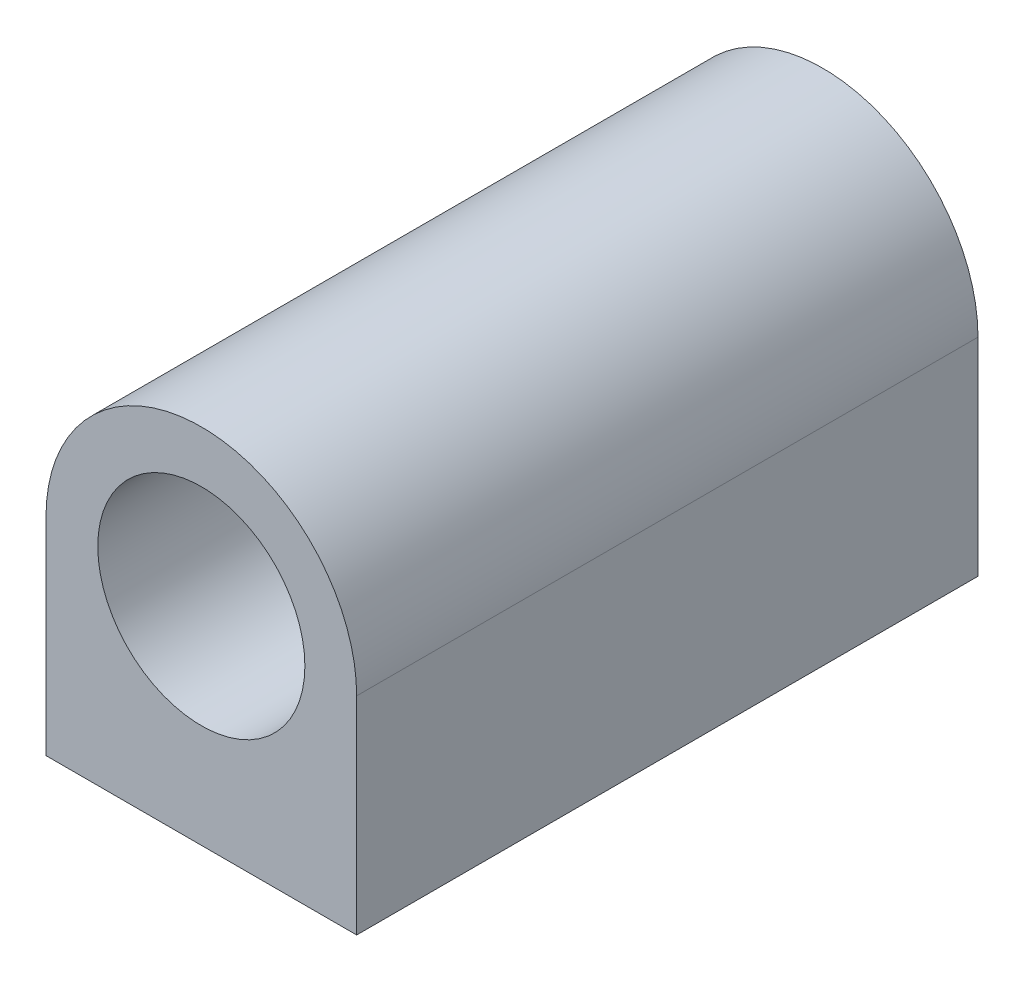
from build123d import *

# Parameters (mm, degrees)
SKETCH1_R           = 12.7
BOSS_EXTRUDE1_DEPTH = 38.1
HOLE1_D             = 3.302
HOLE1_DEPTH         = 12.7
LPATTERN1_COUNT     = 2
LPATTERN1_PITCH     = 25.4


with BuildPart() as part:
    # Sketch1 → Boss-Extrude1 (new, symmetric)
    with BuildSketch(Plane.XY):
        with BuildLine():
            Line((-19.05, 25.4), (-19.05, 0))
            Line((-19.05, 0), (19.05, 0))
            Line((19.05, 0), (19.05, 25.4))
            ThreePointArc((19.05, 25.4), (0, 44.45), (-19.05, 25.4))
        make_face()
        with Locations(Location((0, 25.4, 0), (0, 0, 180))):
            Circle(SKETCH1_R, mode=Mode.SUBTRACT)
    extrude(amount=BOSS_EXTRUDE1_DEPTH, both=True)

    # Hole1
    with Locations(Plane(origin=(0, 0, 0), x_dir=(-1, 0, 0), z_dir=(0, -1, 0))):
        with Locations((-12.7, 31.75), (-12.7, -31.75)):
            hole1 = Hole(HOLE1_D / 2, depth=HOLE1_DEPTH)

    # LPattern1: Hole1 ×2
    with Locations(*[(-i * LPATTERN1_PITCH, 0, 0) for i in range(1, LPATTERN1_COUNT)]):
        add(hole1, mode=Mode.SUBTRACT)


solid = part.part
